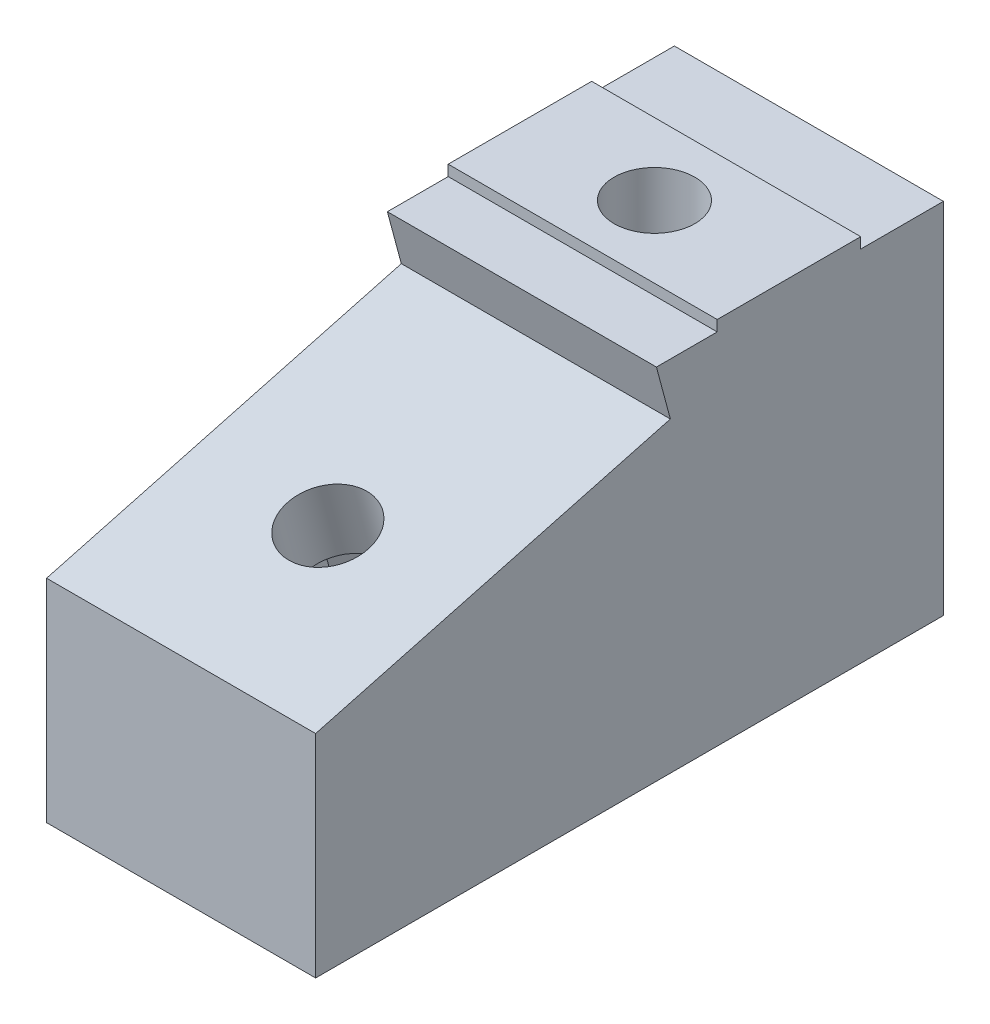
from build123d import *

# Parameters (mm, degrees)
BOSS_EXTRUDE1_DEPTH = 7.5
SKETCH2_R           = 2.25
CUT_EXTRUDE1_DEPTH  = 28.200078529
SKETCH3_R           = 2.25
CUT_EXTRUDE2_DEPTH  = 29.587584718
CUT_EXTRUDE3_START  = -4
CUT_EXTRUDE3_DEPTH  = 24.200078529
SKETCH5_W           = 15
SKETCH5_H           = 8
SKETCH5_R           = 2.25
BOSS_EXTRUDE2_DEPTH = 0.6
SKETCH6_R           = 5
CUT_EXTRUDE4_DEPTH  = 8


with BuildPart() as part:
    # Sketch1 → Boss-Extrude1 (new, symmetric)
    with BuildSketch(Plane(origin=(0, 0, 0), x_dir=(0, 0, -1), z_dir=(1, 0, 0))):
        Polygon((0.776457135, -2.897777479), (-19, -8.196863197), (-19, -20), (16, -20), (16, 0), (0, 0), align=None)
    extrude(amount=BOSS_EXTRUDE1_DEPTH, both=True)

    # Sketch2 → Cut-Extrude1 (cut, through all)
    with BuildSketch(Plane(origin=(0, -2.897777479, -0.776457135), x_dir=(1, 0, 0), z_dir=(0, 0.9659258262890682, 0.2588190451025216))):
        with Locations(Location((0, -12.003847577, 0), (0, 0, 270))):
            Circle(SKETCH2_R)
    extrude(amount=-CUT_EXTRUDE1_DEPTH, mode=Mode.SUBTRACT)

    # Sketch3 → Cut-Extrude2 (cut, through all)
    with BuildSketch(Plane.XZ.offset(20)):
        with Locations(Location((0, -7.39, 0), (0, 0, 270))):
            Circle(SKETCH3_R)
    extrude(amount=-CUT_EXTRUDE2_DEPTH, mode=Mode.SUBTRACT)

    # Sketch4 → Cut-Extrude3 (cut, through all)
    with BuildSketch(Plane(origin=(0, -2.897777479, -0.776457135), x_dir=(1, 0, 0), z_dir=(0, 0.9659258262890681, 0.2588190451025216)).offset(CUT_EXTRUDE3_START)):
        Polygon((0, -16.103034489), (3.55, -14.053441033), (3.55, -9.954254122), (0, -7.904660666), (-3.55, -9.954254122), (-3.55, -14.053441033), align=None)
    extrude(amount=-CUT_EXTRUDE3_DEPTH, mode=Mode.SUBTRACT)

    # Sketch5 → Boss-Extrude2 (add)
    with BuildSketch(Plane(origin=(0, 0, 0), x_dir=(1, 0, 0), z_dir=(0, 1, 0))):
        with Locations((0, 7.39)):
            Rectangle(SKETCH5_W, SKETCH5_H)
        with Locations(Location((0, 7.39, 0), (0, 0, 90))):
            Circle(SKETCH5_R, mode=Mode.SUBTRACT)
    extrude(amount=BOSS_EXTRUDE2_DEPTH)

    # Sketch6 → Cut-Extrude4 (cut)
    with BuildSketch(Plane.XZ.offset(20)):
        with Locations(Location((0, -7.39, 0), (0, 0, 270))):
            Circle(SKETCH6_R)
    extrude(amount=-CUT_EXTRUDE4_DEPTH, mode=Mode.SUBTRACT)


solid = part.part
